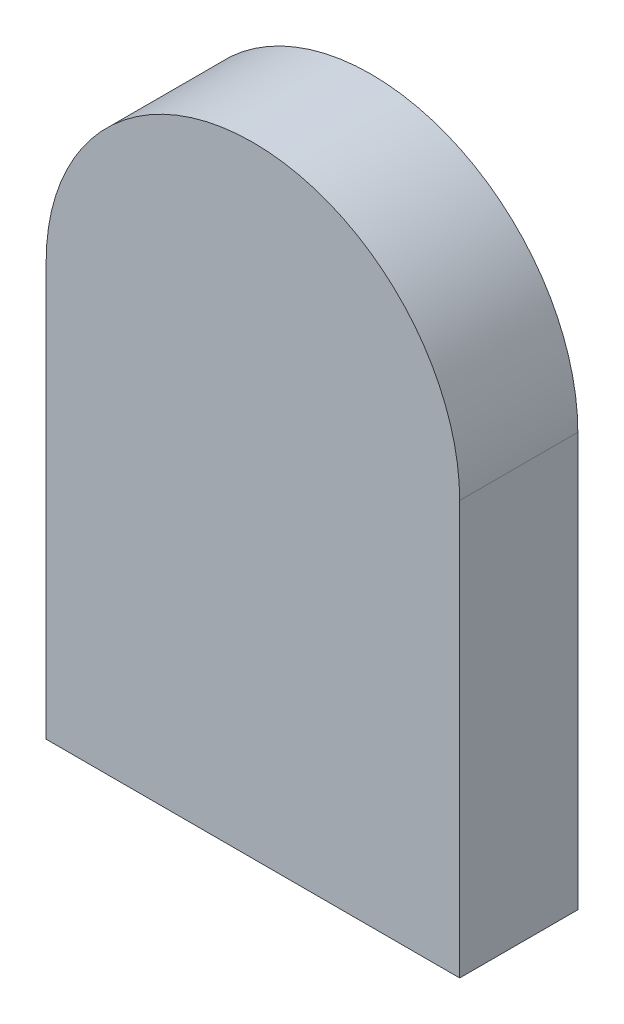
from build123d import *

# Parameters (mm, degrees)
BOSS_EXTRUDE1_DEPTH = 10


with BuildPart() as part:
    # Sketch1 → Boss-Extrude1 (new body)
    with BuildSketch(Plane.XY):
        with BuildLine():
            Line((0, 0), (35, 0))
            Line((35, 0), (35, 35))
            ThreePointArc((35, 35), (17.5, 52.5), (0, 35))
            Line((0, 35), (0, 0))
        make_face()
    extrude(amount=BOSS_EXTRUDE1_DEPTH)


solid = part.part
